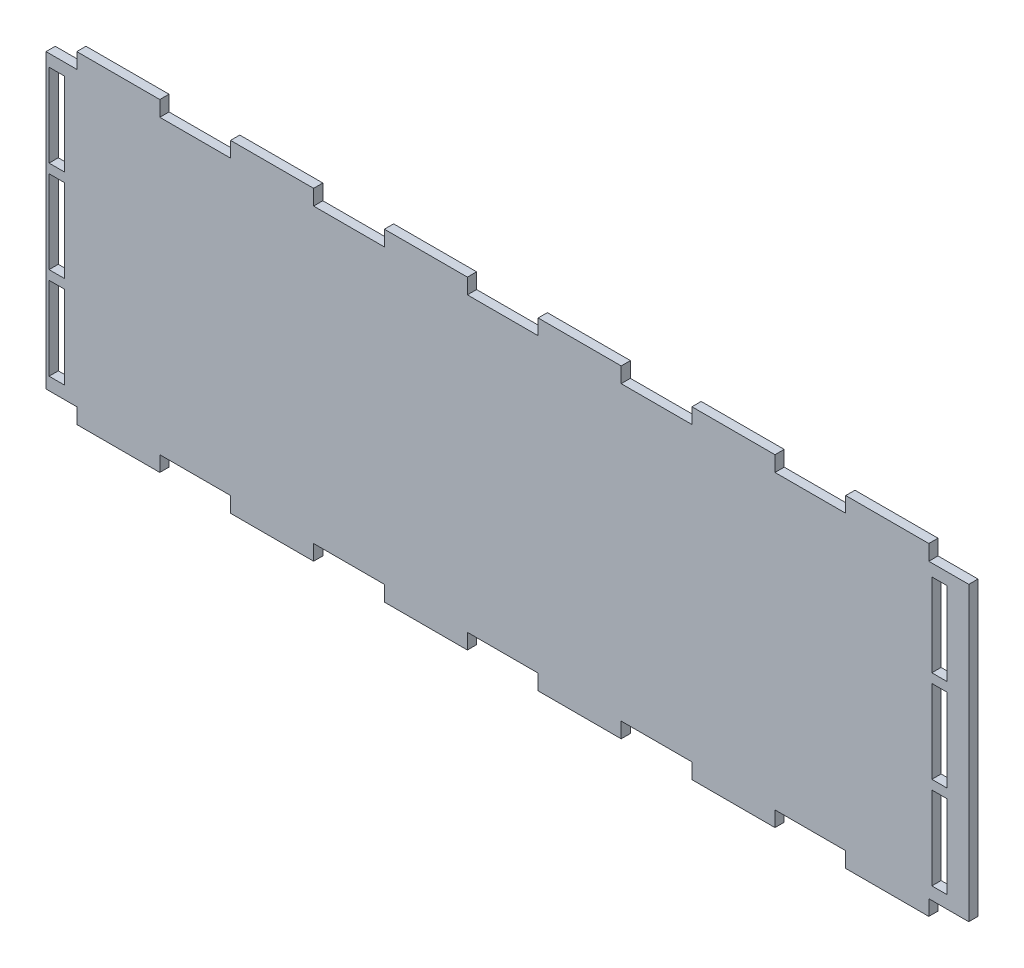
from build123d import *

# Parameters (mm, degrees)
SKETCH1_W           = 5
SKETCH1_H           = 27
BOSS_EXTRUDE1_DEPTH = 3
SKETCH2_W           = 5
SKETCH2_H           = 27
CUT_EXTRUDE1_DEPTH  = 10
SKETCH3_W           = 27
SKETCH3_H           = 5
BOSS_EXTRUDE3_DEPTH = 3


with BuildPart() as part:
    # Sketch1 → Boss-Extrude1 (new body)
    with BuildSketch(Plane.XY):
        Polygon((-90, 52.5), (-90, 47.5), (-113, 47.5), (-113, 52.5), (-140, 52.5), (-140, 47.5), (-150, 47.5), (-150, -47.5), (150, -47.5), (150, 47.5), (137, 47.5), (137, 52.5), (110, 52.5), (110, 47.5), (87, 47.5), (87, 52.5), (60, 52.5), (60, 47.5), (37, 47.5), (37, 52.5), (10, 52.5), (10, 47.5), (-13, 47.5), (-13, 52.5), (-40, 52.5), (-40, 47.5), (-63, 47.5), (-63, 52.5), align=None)
        with Locations((-146.5, 30.102605219)):
            Rectangle(SKETCH1_W, SKETCH1_H, mode=Mode.SUBTRACT)
        with Locations((-146.5, -29.897394781)):
            Rectangle(SKETCH1_W, SKETCH1_H, mode=Mode.SUBTRACT)
        with Locations((-146.5, 0.102605219)):
            Rectangle(SKETCH1_W, SKETCH1_H, mode=Mode.SUBTRACT)
    extrude(amount=BOSS_EXTRUDE1_DEPTH)

    # Sketch2 → Cut-Extrude1 (cut)
    with BuildSketch(Plane.XY.offset(3)):
        with Locations((140.5, 30.1)):
            Rectangle(SKETCH2_W, SKETCH2_H)
        with Locations((140.5, 0.1)):
            Rectangle(SKETCH2_W, SKETCH2_H)
        with Locations((140.5, -29.9)):
            Rectangle(SKETCH2_W, SKETCH2_H)
    extrude(amount=-CUT_EXTRUDE1_DEPTH, mode=Mode.SUBTRACT)

    # Sketch3 → Boss-Extrude3 (add)
    with BuildSketch(Plane.XY.offset(3)):
        with Locations((-126.5, -50)):
            Rectangle(SKETCH3_W, SKETCH3_H)
        with Locations((-76.5, -50)):
            Rectangle(SKETCH3_W, SKETCH3_H)
        with Locations((-26.5, -50)):
            Rectangle(SKETCH3_W, SKETCH3_H)
        with Locations((23.5, -50)):
            Rectangle(SKETCH3_W, SKETCH3_H)
        with Locations((73.5, -50)):
            Rectangle(SKETCH3_W, SKETCH3_H)
        with Locations((123.5, -50)):
            Rectangle(SKETCH3_W, SKETCH3_H)
    extrude(amount=-BOSS_EXTRUDE3_DEPTH)


solid = part.part
